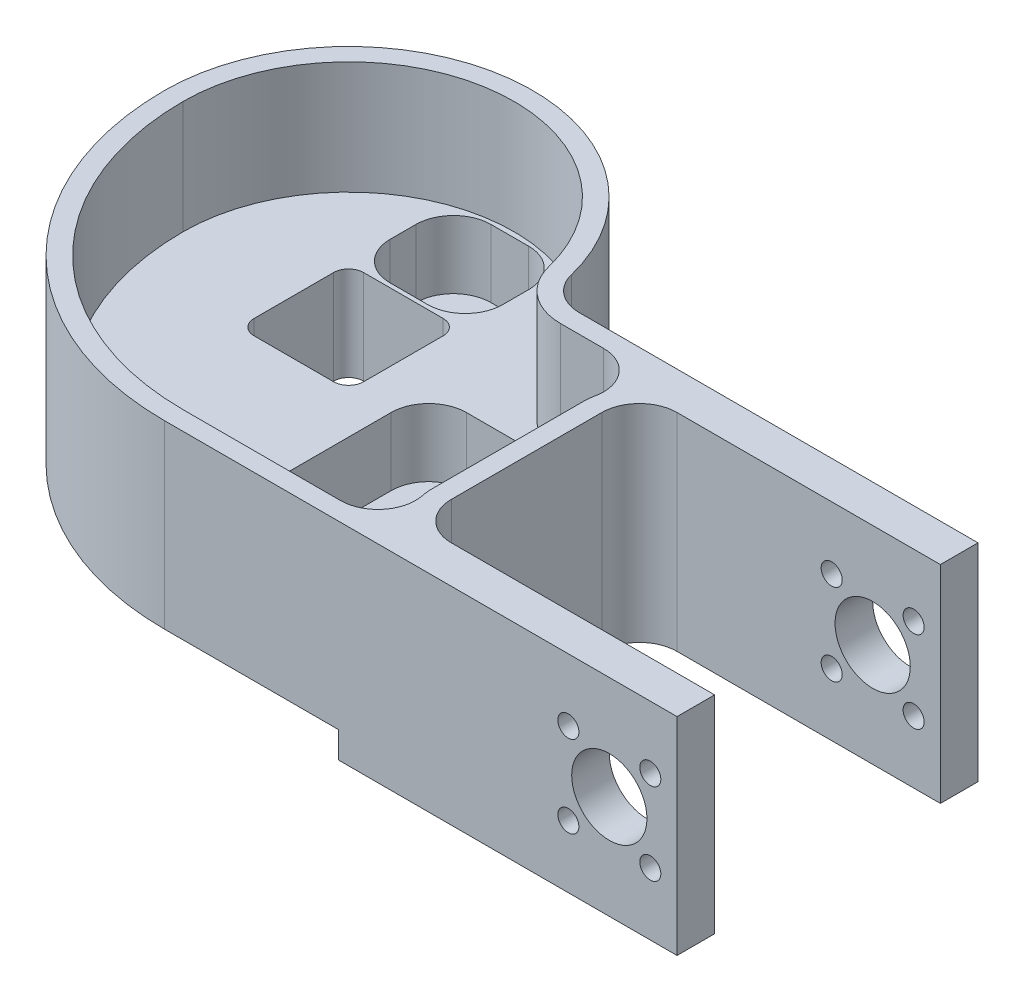
from build123d import *

# Parameters (mm, degrees)
SKETCH1_R           = 31.0896
BOSS_EXTRUDE1_DEPTH = 34.925
BOSS_EXTRUDE2_START = -30.48
BOSS_EXTRUDE2_DEPTH = 30.48
BOSS_EXTRUDE3_DEPTH = 34.925
CUT_EXTRUDE1_REACH  = 122.634
SKETCH4_R           = 6.35
SKETCH4_R_2         = 1.778
SKETCH5_W           = 18.49932761
SKETCH5_H           = 18.49932761
CUT_EXTRUDE2_DEPTH  = 34.925
FILLET3_R           = 2.54
FILLET4_R           = 2.54
FILLET5_R           = 2.54
FILLET6_R           = 2.54
FILLET8_R           = 6.35
FILLET9_R           = 6.35
FILLET10_R          = 6.35
CUT_EXTRUDE3_START  = -19.05
CUT_EXTRUDE3_DEPTH  = 19.05
CUT_EXTRUDE4_DEPTH  = 11.43
CUT_EXTRUDE5_DEPTH  = 11.43


with BuildPart() as part:
    # Sketch1 → Boss-Extrude1 (new body)
    with BuildSketch(Plane(origin=(0, 0, 0), x_dir=(1, 0, 0), z_dir=(0, 1, 0))):
        with Locations(Location((0, 0, 0), (0, 0, 270))):
            Circle(SKETCH1_R)
    extrude(amount=BOSS_EXTRUDE1_DEPTH)

    # Sketch2 → Boss-Extrude2 (add)
    with BuildSketch(Plane(origin=(0, 34.925, 0), x_dir=(1, 0, 0), z_dir=(0, 1, 0)).offset(BOSS_EXTRUDE2_START)):
        with BuildLine():
            Line((46.542690567, -48.26), (17.1704, -48.26))
            ThreePointArc((17.1704, -48.26), (-16.95457326, -34.12497326), (-31.0896, 0))
            ThreePointArc((-31.0896, 0), (1.271062728, -31.063606161), (30.985668109, 2.54))
            Line((30.985668109, 2.54), (46.542690567, 2.54))
            Line((46.542690567, 2.54), (46.542690567, -48.26))
        make_face()
    extrude(amount=BOSS_EXTRUDE2_DEPTH)

    # Sketch3 → Boss-Extrude3 (add)
    with BuildSketch(Plane(origin=(0, 34.925, 0), x_dir=(1, 0, 0), z_dir=(0, 1, 0))):
        Polygon((46.542690567, -0.333607673), (46.542690567, -48.26), (103.692690567, -48.26), (103.692690567, -41.91), (52.892690567, -41.91), (52.892690567, -3.81), (103.692690567, -3.81), (103.692690567, 2.54), (46.542690567, 2.54), align=None)
    extrude(amount=-BOSS_EXTRUDE3_DEPTH)

    # Cut-Extrude1: up to this face of the body (flat: up to its plane)
    cut_extrude1_end = Plane(part.part.faces().sort_by_distance((61.721911557, 18.150695346, 48.26))[0])
    # Sketch4 → Cut-Extrude1 (cut, up to the picked face)
    with BuildSketch(Plane(origin=(0, 0, -2.54), x_dir=(-1, 0, 0), z_dir=(0, 0, -1)), mode=Mode.PRIVATE) as cut_extrude1_sk1:
        with Locations((-92.262690567, 17.4625)):
            Circle(SKETCH4_R)
    cut_extrude1_tool1 = split(extrude(cut_extrude1_sk1.sketch, amount=-CUT_EXTRUDE1_REACH, mode=Mode.PRIVATE), bisect_by=cut_extrude1_end, keep=Keep.BOTH, mode=Mode.PRIVATE)
    # Sketch4 → Cut-Extrude1 (cut, up to the picked face)
    with BuildSketch(Plane(origin=(0, 0, -2.54), x_dir=(-1, 0, 0), z_dir=(0, 0, -1)), mode=Mode.PRIVATE) as cut_extrude1_sk2:
        with Locations((-85.347893353, 10.547702787)):
            Circle(SKETCH4_R_2)
    cut_extrude1_tool2 = split(extrude(cut_extrude1_sk2.sketch, amount=-CUT_EXTRUDE1_REACH, mode=Mode.PRIVATE), bisect_by=cut_extrude1_end, keep=Keep.BOTH, mode=Mode.PRIVATE)
    # Sketch4 → Cut-Extrude1 (cut, up to the picked face)
    with BuildSketch(Plane(origin=(0, 0, -2.54), x_dir=(-1, 0, 0), z_dir=(0, 0, -1)), mode=Mode.PRIVATE) as cut_extrude1_sk3:
        with Locations((-99.17748778, 24.377297213)):
            Circle(SKETCH4_R_2)
    cut_extrude1_tool3 = split(extrude(cut_extrude1_sk3.sketch, amount=-CUT_EXTRUDE1_REACH, mode=Mode.PRIVATE), bisect_by=cut_extrude1_end, keep=Keep.BOTH, mode=Mode.PRIVATE)
    # Sketch4 → Cut-Extrude1 (cut, up to the picked face)
    with BuildSketch(Plane(origin=(0, 0, -2.54), x_dir=(-1, 0, 0), z_dir=(0, 0, -1)), mode=Mode.PRIVATE) as cut_extrude1_sk4:
        with Locations((-99.17748778, 10.547702787)):
            Circle(SKETCH4_R_2)
    cut_extrude1_tool4 = split(extrude(cut_extrude1_sk4.sketch, amount=-CUT_EXTRUDE1_REACH, mode=Mode.PRIVATE), bisect_by=cut_extrude1_end, keep=Keep.BOTH, mode=Mode.PRIVATE)
    # Sketch4 → Cut-Extrude1 (cut, up to the picked face)
    with BuildSketch(Plane(origin=(0, 0, -2.54), x_dir=(-1, 0, 0), z_dir=(0, 0, -1)), mode=Mode.PRIVATE) as cut_extrude1_sk5:
        with Locations((-85.347893353, 24.377297213)):
            Circle(SKETCH4_R_2)
    cut_extrude1_tool5 = split(extrude(cut_extrude1_sk5.sketch, amount=-CUT_EXTRUDE1_REACH, mode=Mode.PRIVATE), bisect_by=cut_extrude1_end, keep=Keep.BOTH, mode=Mode.PRIVATE)
    add(cut_extrude1_tool1.solids().sort_by(Axis((92.262691, 17.4625, -2.54), (0, 0, 1)))[0], mode=Mode.SUBTRACT)
    add(cut_extrude1_tool2.solids().sort_by(Axis((85.347893, 10.547703, -2.54), (0, 0, 1)))[0], mode=Mode.SUBTRACT)
    add(cut_extrude1_tool3.solids().sort_by(Axis((99.177488, 24.377297, -2.54), (0, 0, 1)))[0], mode=Mode.SUBTRACT)
    add(cut_extrude1_tool4.solids().sort_by(Axis((99.177488, 10.547703, -2.54), (0, 0, 1)))[0], mode=Mode.SUBTRACT)
    add(cut_extrude1_tool5.solids().sort_by(Axis((85.347893, 24.377297, -2.54), (0, 0, 1)))[0], mode=Mode.SUBTRACT)

    # Sketch5 → Cut-Extrude2 (cut)
    with BuildSketch(Plane(origin=(0, 34.925, 0), x_dir=(1, 0, 0), z_dir=(0, 1, 0))):
        Rectangle(SKETCH5_W, SKETCH5_H)
    extrude(amount=-CUT_EXTRUDE2_DEPTH, mode=Mode.SUBTRACT)

    # Fillet3
    fillet3_edges = [part.edges().sort_by_distance(p)[0] for p in [
        (-9.249663805, 17.4625, 9.249663805),
    ]]
    fillet(fillet3_edges, radius=FILLET3_R)

    # Fillet4
    fillet4_edges = [part.edges().sort_by_distance(p)[0] for p in [
        (-9.249663805, 17.4625, -9.249663805),
    ]]
    fillet(fillet4_edges, radius=FILLET4_R)

    # Fillet5
    fillet5_edges = [part.edges().sort_by_distance(p)[0] for p in [
        (9.249663805, 17.4625, -9.249663805),
    ]]
    fillet(fillet5_edges, radius=FILLET5_R)

    # Fillet6
    fillet6_edges = [part.edges().sort_by_distance(p)[0] for p in [
        (9.249663805, 17.4625, 9.249663805),
    ]]
    fillet(fillet6_edges, radius=FILLET6_R)

    # Fillet8
    fillet8_edges = [part.edges().sort_by_distance(p)[0] for p in [
        (30.985668109, 19.685, -2.54),
    ]]
    fillet(fillet8_edges, radius=FILLET8_R)

    # Fillet9
    fillet9_edges = [part.edges().sort_by_distance(p)[0] for p in [
        (52.892690567, 17.4625, 41.91),
    ]]
    fillet(fillet9_edges, radius=FILLET9_R)

    # Fillet10
    fillet10_edges = [part.edges().sort_by_distance(p)[0] for p in [
        (52.892690567, 17.4625, 3.81),
    ]]
    fillet(fillet10_edges, radius=FILLET10_R)

    # Sketch6 → Cut-Extrude3 (cut)
    with BuildSketch(Plane(origin=(0, 34.925, 0), x_dir=(1, 0, 0), z_dir=(0, 1, 0)).offset(CUT_EXTRUDE3_START)):
        with BuildLine():
            ThreePointArc((49.910134647, -8.255), (49.765923709, -9.202652137), (49.717690567, -10.16))
            Line((49.717690567, -10.16), (49.717690567, -35.56))
            ThreePointArc((49.717690567, -35.56), (49.765923709, -36.517347863), (49.910134647, -37.465))
            ThreePointArc((49.910134647, -37.465), (48.60711955, -42.751092628), (43.6884307, -45.085))
            Line((43.6884307, -45.085), (17.1704, -45.085))
            ThreePointArc((17.1704, -45.085), (-14.70950923, -31.87990923), (-27.9146, 0))
            ThreePointArc((-27.9146, 0), (-3.338101965, 27.714291772), (27.116241813, 6.628297151))
            ThreePointArc((27.116241813, 6.628297151), (30.48737672, 1.397725825), (36.368826599, -0.635))
            Line((36.368826599, -0.635), (43.6884307, -0.635))
            ThreePointArc((43.6884307, -0.635), (48.60711955, -2.968907372), (49.910134647, -8.255))
        make_face()
        with BuildLine():
            ThreePointArc((6.709663805, 9.249663805), (8.505715029, 8.505715029), (9.249663805, 6.709663805))
            Line((9.249663805, 6.709663805), (9.249663805, -6.709663805))
            ThreePointArc((9.249663805, -6.709663805), (8.505715029, -8.505715029), (6.709663805, -9.249663805))
            Line((6.709663805, -9.249663805), (-6.709663805, -9.249663805))
            ThreePointArc((-6.709663805, -9.249663805), (-8.505715029, -8.505715029), (-9.249663805, -6.709663805))
            Line((-9.249663805, -6.709663805), (-9.249663805, 6.709663805))
            ThreePointArc((-9.249663805, 6.709663805), (-8.505715029, 8.505715029), (-6.709663805, 9.249663805))
            Line((-6.709663805, 9.249663805), (6.709663805, 9.249663805))
        make_face(mode=Mode.SUBTRACT)
    extrude(amount=CUT_EXTRUDE3_DEPTH, mode=Mode.SUBTRACT)

    # Sketch8 → Cut-Extrude4 (cut)
    with BuildSketch(Plane(origin=(0, 15.875, 0), x_dir=(1, 0, 0), z_dir=(0, 1, 0))):
        with BuildLine():
            Line((22.412690567, -2.54), (41.462690567, -2.54))
            ThreePointArc((41.462690567, -2.54), (45.952818627, -4.399871939), (47.812690567, -8.89))
            Line((47.812690567, -8.89), (47.812690567, -36.83))
            ThreePointArc((47.812690567, -36.83), (45.952818627, -41.320128061), (41.462690567, -43.18))
            Line((41.462690567, -43.18), (22.412690567, -43.18))
            ThreePointArc((22.412690567, -43.18), (17.922562506, -41.320128061), (16.062690567, -36.83))
            Line((16.062690567, -36.83), (16.062690567, -8.89))
            ThreePointArc((16.062690567, -8.89), (17.922562506, -4.399871939), (22.412690567, -2.54))
        make_face()
    extrude(amount=-CUT_EXTRUDE4_DEPTH, mode=Mode.SUBTRACT)

    # Sketch9 → Cut-Extrude5 (cut)
    with BuildSketch(Plane(origin=(0, 15.875, 0), x_dir=(1, 0, 0), z_dir=(0, 1, 0))):
        with BuildLine():
            Line((-9.337309433, 20.679663805), (-9.337309433, 16.320204994))
            ThreePointArc((-9.337309433, 16.320204994), (-7.477437494, 11.830076933), (-2.987309433, 9.970204994))
            Line((-2.987309433, 9.970204994), (3.362690567, 9.970204994))
            ThreePointArc((3.362690567, 9.970204994), (7.852818627, 11.830076933), (9.712690567, 16.320204994))
            Line((9.712690567, 16.320204994), (9.712690567, 20.679663805))
            ThreePointArc((9.712690567, 20.679663805), (7.852818627, 25.169791865), (3.362690567, 27.029663805))
            Line((3.362690567, 27.029663805), (-2.987309433, 27.029663805))
            ThreePointArc((-2.987309433, 27.029663805), (-7.477437494, 25.169791865), (-9.337309433, 20.679663805))
        make_face()
    extrude(amount=-CUT_EXTRUDE5_DEPTH, mode=Mode.SUBTRACT)


solid = part.part
